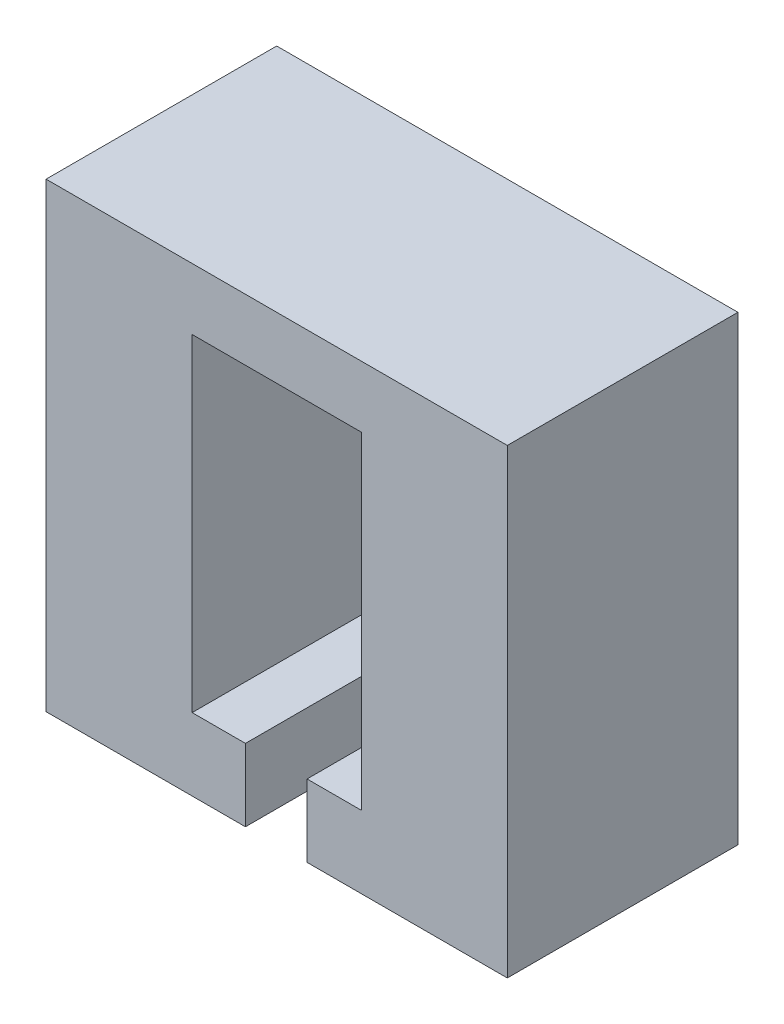
from build123d import *

# Parameters (mm, degrees)
SKETCH1_W           = 60
SKETCH1_H           = 60
BOSS_EXTRUDE1_DEPTH = 30
SKETCH2_W           = 22
SKETCH2_H           = 42.6
CUT_EXTRUDE1_DEPTH  = 59.89947825
SKETCH4_W           = 8.015676437
SKETCH4_H           = 9.4
CUT_EXTRUDE3_DEPTH  = 59.89947825


with BuildPart() as part:
    # Sketch1 → Boss-Extrude1 (new body)
    with BuildSketch(Plane(origin=(0, 0, 7.302957559), x_dir=(-1, 0, 0), z_dir=(0, 0, -1))):
        with Locations((-2.674729751, 8.74932998)):
            Rectangle(SKETCH1_W, SKETCH1_H)
    extrude(amount=BOSS_EXTRUDE1_DEPTH)

    # Sketch2 → Cut-Extrude1 (cut, through all)
    with BuildSketch(Plane(origin=(0, 0, -22.697042441), x_dir=(-1, 0, 0), z_dir=(0, 0, -1))):
        with Locations((-2.674729751, 9.44932998)):
            Rectangle(SKETCH2_W, SKETCH2_H)
    extrude(amount=-CUT_EXTRUDE1_DEPTH, mode=Mode.SUBTRACT)

    # Sketch4 → Cut-Extrude3 (cut, through all)
    with BuildSketch(Plane(origin=(0, 0, -22.697042441), x_dir=(-1, 0, 0), z_dir=(0, 0, -1))):
        with Locations((-2.616126324, -16.55067002)):
            Rectangle(SKETCH4_W, SKETCH4_H)
    extrude(amount=-CUT_EXTRUDE3_DEPTH, mode=Mode.SUBTRACT)


solid = part.part
